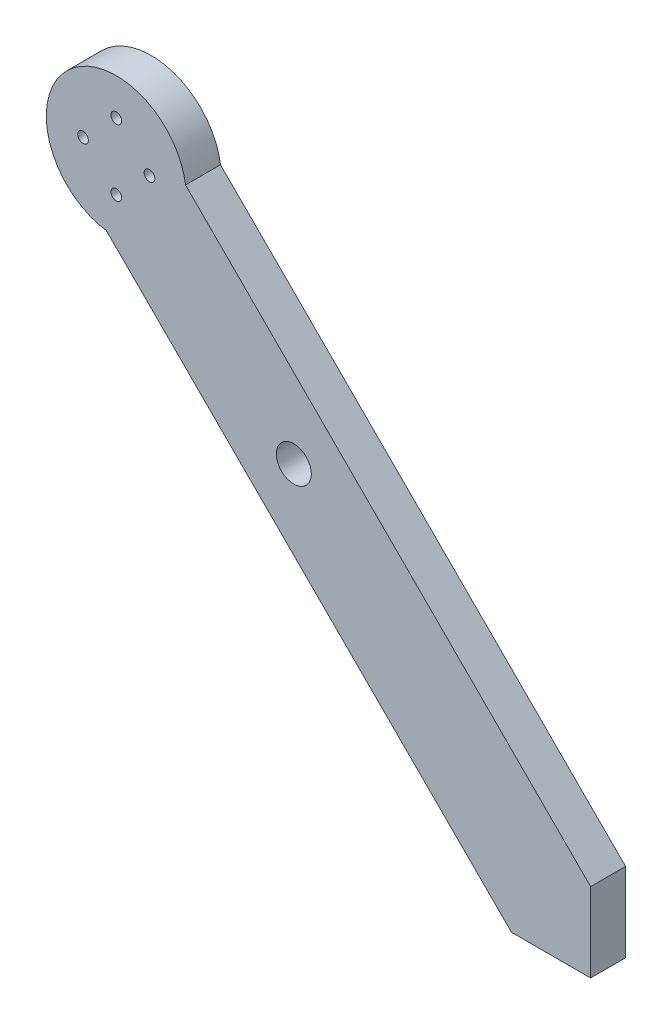
from build123d import *

# Parameters (mm, degrees)
BOSS_EXTRU_1_DEPTH      = 10
ESQUISSE2_R             = 4.5
BOSS_EXTRU_2_DEPTH      = 5
ESQUISSE3_R             = 1.525
ESQUISSE3_R_2           = 5
ENL_V_MAT_EXTRU_1_DEPTH = 221.29310456


with BuildPart() as part:
    # Esquisse1 → Boss.-Extru.1 (new body)
    with BuildSketch(Plane.XY):
        with BuildLine():
            Line((-55, 32.372583002), (-22.627416998, 0))
            Line((-22.627416998, 0), (0, 0))
            Line((0, 0), (0, 22.627416998))
            Line((0, 22.627416998), (-32.372583002, 55))
            Line((-32.372583002, 55), (-115.811183182, 138.43860018))
            ThreePointArc((-115.811183182, 138.43860018), (-115.660488879, 137.027953457), (-115.610173055, 135.610173055))
            ThreePointArc((-115.610173055, 135.610173055), (-122.506138228, 120.501093955), (-138.43860018, 115.811183182))
            Line((-138.43860018, 115.811183182), (-55, 32.372583002))
        make_face()
        with BuildLine():
            ThreePointArc((-115.811183182, 138.43860018), (-149.752308679, 149.752308679), (-138.43860018, 115.811183182))
            Line((-138.43860018, 115.811183182), (-146.923881554, 124.296464556))
            Line((-146.923881554, 124.296464556), (-124.296464556, 146.923881554))
            Line((-124.296464556, 146.923881554), (-115.811183182, 138.43860018))
        make_face()
        with BuildLine():
            Line((-146.923881554, 124.296464556), (-138.43860018, 115.811183182))
            ThreePointArc((-138.43860018, 115.811183182), (-122.506138228, 120.501093955), (-115.610173055, 135.610173055))
            ThreePointArc((-115.610173055, 135.610173055), (-115.660488879, 137.027953457), (-115.811183182, 138.43860018))
            Line((-115.811183182, 138.43860018), (-124.296464556, 146.923881554))
            Line((-124.296464556, 146.923881554), (-146.923881554, 124.296464556))
        make_face()
    extrude(amount=BOSS_EXTRU_1_DEPTH)

    # Esquisse2 → Boss.-Extru.2 (add)
    with BuildSketch(Plane(origin=(0, 0, 0), x_dir=(-1, 0, 0), z_dir=(0, 0, -1))):
        with Locations(Location((31.819805153, 31.819805153, 0), (0, 0, 180))):
            Circle(ESQUISSE2_R)
        with Locations(Location((14.142135624, 14.142135624, 0), (0, 0, 180))):
            Circle(ESQUISSE2_R)
    extrude(amount=BOSS_EXTRU_2_DEPTH)

    # Esquisse3 → Enlèv. mat.-Extru.1 (cut, through all)
    with BuildSketch(Plane(origin=(0, 0, 0), x_dir=(-1, 0, 0), z_dir=(0, 0, -1))):
        with Locations((135.610173055, 145.110173055)):
            Circle(ESQUISSE3_R)
        with Locations((145.110173055, 135.610173055)):
            Circle(ESQUISSE3_R)
        with Locations((135.610173055, 126.110173055)):
            Circle(ESQUISSE3_R)
        with Locations((126.110173055, 135.610173055)):
            Circle(ESQUISSE3_R)
        with Locations((84.852813742, 84.852813742)):
            Circle(ESQUISSE3_R_2)
    extrude(amount=-ENL_V_MAT_EXTRU_1_DEPTH, mode=Mode.SUBTRACT)


solid = part.part
